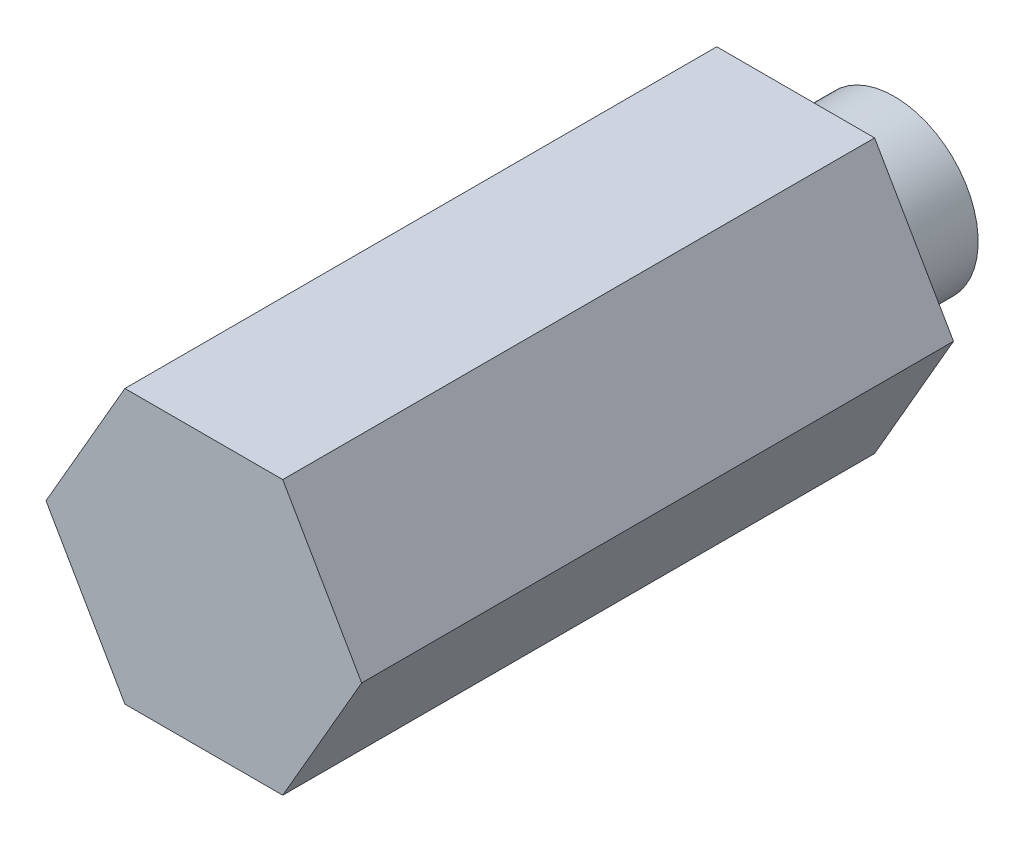
from build123d import *

# Parameters (mm, degrees)
EXTRUDE_1_DEPTH = 12
SKETCH_2_R      = 1.7
EXTRUDE_2_DEPTH = 2


with BuildPart() as part:
    # 草图1 → 凸台-拉伸1 (new body)
    with BuildSketch(Plane.XY):
        Polygon((1.6, 2.771281292), (-1.6, 2.771281292), (-3.2, 0), (-1.6, -2.771281292), (1.6, -2.771281292), (3.2, 0), align=None)
    extrude(amount=EXTRUDE_1_DEPTH)

    # 草图2 → 凸台-拉伸2 (add)
    with BuildSketch(Plane(origin=(0, 0, 0), x_dir=(-1, 0, 0), z_dir=(0, 0, -1))):
        Circle(SKETCH_2_R)
    extrude(amount=EXTRUDE_2_DEPTH)


solid = part.part
